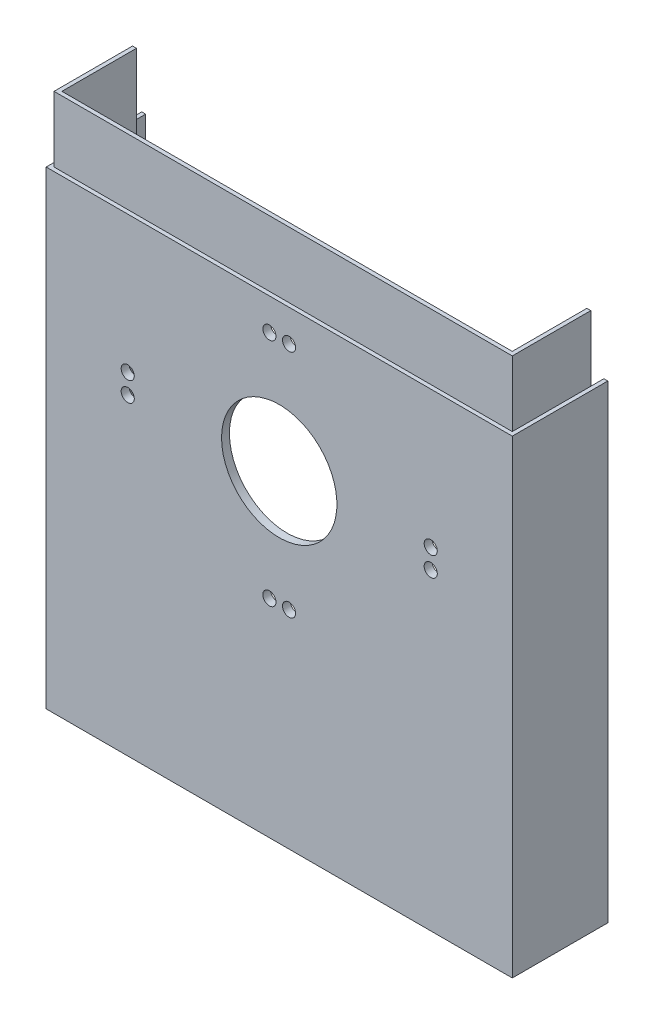
from build123d import *

# Parameters (mm, degrees)
SKETCH1_W           = 177.8
SKETCH1_H           = 254
BOSS_EXTRUDE1_DEPTH = 36.445
SHELL1_T            = 3
SKETCH2_R           = 22
SKETCH2_R_2         = 2.5
CUT_EXTRUDE1_DEPTH  = 3
SKETCH3_R           = 5
CUT_EXTRUDE2_DEPTH  = 3
SKETCH12_W          = 12
SKETCH12_H          = 66.89
BOSS_EXTRUDE5_DEPTH = 8
SKETCH10_R          = 3
CUT_EXTRUDE8_DEPTH  = 8
SKETCH13_W          = 174.8
SKETCH13_H          = 69.89
SKETCH13_W_2        = 171.8
SKETCH13_H_2        = 66.89
BOSS_EXTRUDE6_DEPTH = 25
SKETCH14_W          = 175.3
SKETCH14_H          = 70.39
SKETCH14_W_2        = 171.8
SKETCH14_H_2        = 66.89
CUT_EXTRUDE9_DEPTH  = 10
SKETCH17_W          = 171.8
SKETCH17_H          = 66.89
BOSS_EXTRUDE7_DEPTH = 2
SKETCH22_W          = 5
SKETCH22_H          = 5
CUT_EXTRUDE14_DEPTH = 5
BOSS_EXTRUDE8_DEPTH = 5
CUT_EXTRUDE12_DEPTH = 5
SKETCH21_W          = 23.209480822
SKETCH21_H          = 1.5
CUT_EXTRUDE13_DEPTH = 5


with BuildPart() as part:
    # Sketch1 → Boss-Extrude1 (new, symmetric)
    with BuildSketch(Plane.XY):
        Rectangle(SKETCH1_W, SKETCH1_H)
    extrude(amount=BOSS_EXTRUDE1_DEPTH, both=True)

    # Shell1 (no face opened: a closed hollow body)
    add(offset(amount=-SHELL1_T, mode=Mode.PRIVATE), mode=Mode.SUBTRACT)

    # Sketch2 → Cut-Extrude1 (cut)
    with BuildSketch(Plane(origin=(0, 0, 33.445), x_dir=(-1, 0, 0), z_dir=(0, 0, -1))):
        with Locations((0, -4)):
            Circle(SKETCH2_R)
        with Locations((-3.75, -47.907937278)):
            Circle(SKETCH2_R_2)
        with Locations((3.75, -47.907937278)):
            Circle(SKETCH2_R_2)
        with Locations((-57.788969133, -0.25)):
            Circle(SKETCH2_R_2)
        with Locations((-57.788969133, -7.75)):
            Circle(SKETCH2_R_2)
        with Locations(Location((57.788969133, -0.25, 0), (0, 0, 180))):
            Circle(SKETCH2_R_2)
        with Locations(Location((57.788969133, -7.75, 0), (0, 0, 180))):
            Circle(SKETCH2_R_2)
        with Locations(Location((3.75, 39.907937278, 0), (0, 0, 180))):
            Circle(SKETCH2_R_2)
        with Locations(Location((-3.75, 39.907937278, 0), (0, 0, 180))):
            Circle(SKETCH2_R_2)
    extrude(amount=-CUT_EXTRUDE1_DEPTH, mode=Mode.SUBTRACT)

    # Sketch3 → Cut-Extrude2 (cut)
    with BuildSketch(Plane.XY.offset(-33.445)):
        with Locations((-20.9, 34)):
            Circle(SKETCH3_R)
    extrude(amount=-CUT_EXTRUDE2_DEPTH, mode=Mode.SUBTRACT)

    # Sketch12 → Boss-Extrude5 (add)
    with BuildSketch(Plane.XZ.offset(-124)):
        Rectangle(SKETCH12_W, SKETCH12_H)
    extrude(amount=BOSS_EXTRUDE5_DEPTH)

    # Sketch10 → Cut-Extrude8 (cut)
    with BuildSketch(Plane(origin=(0, 127, 0), x_dir=(1, 0, 0), z_dir=(0, 1, 0))):
        with Locations(Location((0, 0, 0), (0, 0, 270))):
            Circle(SKETCH10_R)
    extrude(amount=-CUT_EXTRUDE8_DEPTH, mode=Mode.SUBTRACT)


with BuildPart() as body_2:
    # Split2: the piece on the far side of the plane
    add(part.part)
    split(bisect_by=Plane.ZX.offset(52), keep=Keep.BOTTOM)

    # Sketch13 → Boss-Extrude6 (add)
    with BuildSketch(Plane(origin=(0, 52, 0), x_dir=(1, 0, 0), z_dir=(0, 1, 0))):
        Rectangle(SKETCH13_W, SKETCH13_H)
        Rectangle(SKETCH13_W_2, SKETCH13_H_2, mode=Mode.SUBTRACT)
    extrude(amount=BOSS_EXTRUDE6_DEPTH)

    # Sketch17 → Boss-Extrude7 (add)
    with BuildSketch(Plane(origin=(0, -124, 0), x_dir=(1, 0, 0), z_dir=(0, 1, 0))):
        Rectangle(SKETCH17_W, SKETCH17_H)
    extrude(amount=BOSS_EXTRUDE7_DEPTH)

    # Sketch22 → Cut-Extrude14 (cut)
    with BuildSketch(Plane.XZ.offset(127)):
        Polygon((11.604740411, 0), (5.802370205, 10.05), (-5.802370205, 10.05), (-11.604740411, 0), (-5.802370205, -10.05), (5.802370205, -10.05), align=None)
        with Locations((-17.67766953, 17.67766953)):
            Rectangle(SKETCH22_W, SKETCH22_H)
        with Locations((17.67766953, 17.67766953)):
            Rectangle(SKETCH22_W, SKETCH22_H)
        with Locations((17.67766953, -17.67766953)):
            Rectangle(SKETCH22_W, SKETCH22_H)
        with Locations((-17.67766953, -17.67766953)):
            Rectangle(SKETCH22_W, SKETCH22_H)
    extrude(amount=-CUT_EXTRUDE14_DEPTH, mode=Mode.SUBTRACT)


with BuildPart() as part_1:
    add(part.part)

    # Split2
    split(bisect_by=Plane.ZX.offset(52), keep=Keep.TOP)

    # Sketch14 → Cut-Extrude9 (cut)
    with BuildSketch(Plane.XZ.offset(-52)):
        Rectangle(SKETCH14_W, SKETCH14_H)
        Rectangle(SKETCH14_W_2, SKETCH14_H_2, mode=Mode.SUBTRACT)
    extrude(amount=-CUT_EXTRUDE9_DEPTH, mode=Mode.SUBTRACT)


with BuildPart() as body_3:
    # Split3: the piece on the far side of the plane
    add(body_2.part)
    split(bisect_by=Plane.XY, keep=Keep.BOTTOM)

    # Sketch19 → Boss-Extrude8 (add)
    with BuildSketch(Plane.XY):
        Polygon((-87.4, 77), (-85.9, 77), (-85.9, 75.5), (-85.9, -122), (-11.604740411, -122), (-11.604740411, -123.5), (-87.4, -123.5), align=None)
        Polygon((87.4, 77), (87.4, -123.5), (11.604740411, -123.5), (11.604740411, -122), (85.9, -122), (85.9, 75.5), (85.9, 77), align=None)
    extrude(amount=BOSS_EXTRUDE8_DEPTH)


with BuildPart() as body_2_1:
    add(body_2.part)

    # Split3
    split(bisect_by=Plane.XY, keep=Keep.TOP)

    # Sketch20 → Cut-Extrude12 (cut)
    with BuildSketch(Plane(origin=(0, 0, 0), x_dir=(-1, 0, 0), z_dir=(0, 0, -1))):
        Polygon((-87.4, 77), (-87.4, -123.5), (-11.604740411, -123.5), (-11.604740411, -122), (-85.9, -122), (-85.9, 77), align=None)
        Polygon((85.9, 77), (85.9, -122), (11.604740411, -122), (11.604740411, -123.5), (87.4, -123.5), (87.4, 77), align=None)
    extrude(amount=-CUT_EXTRUDE12_DEPTH, mode=Mode.SUBTRACT)

    # Sketch21 → Cut-Extrude13 (cut)
    with BuildSketch(Plane(origin=(0, 0, 0), x_dir=(-1, 0, 0), z_dir=(0, 0, -1))):
        with Locations((0, -122.75)):
            Rectangle(SKETCH21_W, SKETCH21_H)
    extrude(amount=-CUT_EXTRUDE13_DEPTH, mode=Mode.SUBTRACT)


solid = body_2_1.part
